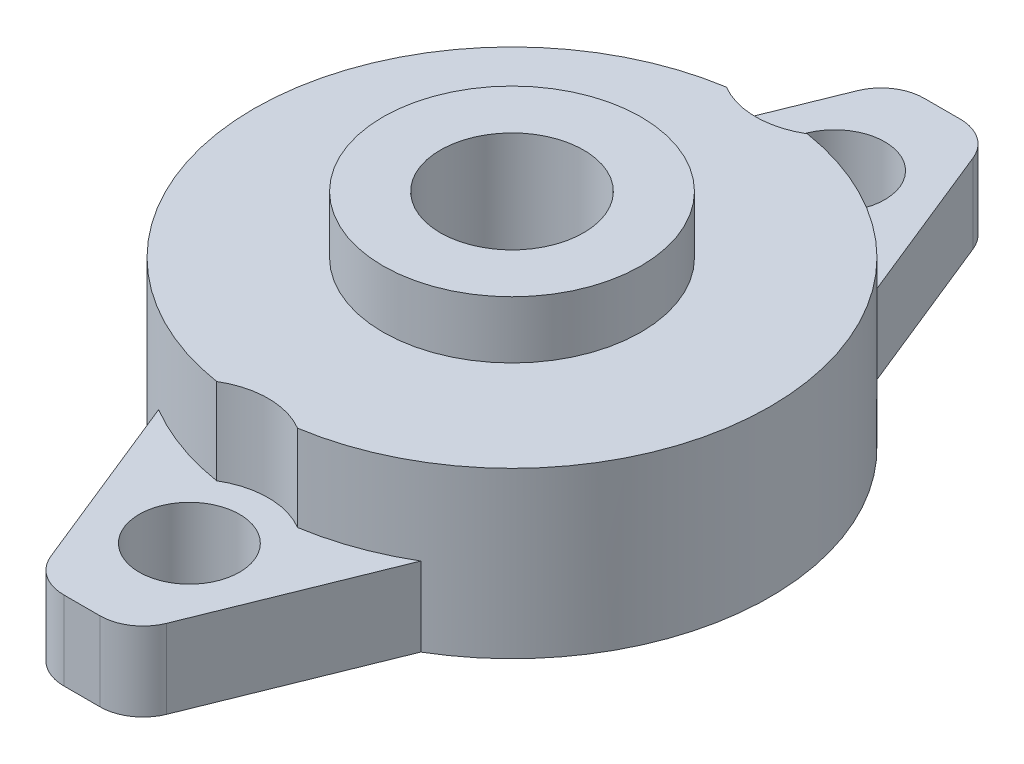
from build123d import *

# Parameters (mm, degrees)
SKETCH1_R      = 3.5
EXTRUDE1_DEPTH = 5.5
EXTRUDE2_DEPTH = 6
SKETCH3_R      = 9
EXTRUDE3_DEPTH = 4
SKETCH4_R      = 5
EXTRUDE4_DEPTH = 20
SKETCH5_R      = 14
EXTRUDE5_DEPTH = 1.5


with BuildPart() as part:
    # Sketch1 → Extrude1 (new body)
    with BuildSketch(Plane(origin=(0, 0, 0), x_dir=(1, 0, 0), z_dir=(0, 1, 0))):
        with BuildLine():
            Line((-9.142025191, 15.505591746), (-4.043990115, 28.123809223))
            ThreePointArc((-4.043990115, 28.123809223), (-2.940017716, 29.487109534), (-1.262434286, 30))
            Line((-1.262434286, 30), (1.262434286, 30))
            ThreePointArc((1.262434286, 30), (2.940017716, 29.487109534), (4.043990115, 28.123809223))
            Line((4.043990115, 28.123809223), (9.142025191, 15.505591746))
            ThreePointArc((9.142025191, 15.505591746), (18, 0), (9.142025191, -15.505591746))
            Line((9.142025191, -15.505591746), (4.043990115, -28.123809223))
            ThreePointArc((4.043990115, -28.123809223), (2.940017716, -29.487109534), (1.262434286, -30))
            Line((1.262434286, -30), (-1.262434286, -30))
            ThreePointArc((-1.262434286, -30), (-2.940017716, -29.487109534), (-4.043990115, -28.123809223))
            Line((-4.043990115, -28.123809223), (-9.142025191, -15.505591746))
            ThreePointArc((-9.142025191, -15.505591746), (-18, 0), (-9.142025191, 15.505591746))
        make_face()
        with Locations(Location((0, 22.5, 0), (0, 0, 270))):
            Circle(SKETCH1_R, mode=Mode.SUBTRACT)
        with Locations(Location((0, -22.5, 0), (0, 0, 270))):
            Circle(SKETCH1_R, mode=Mode.SUBTRACT)
    extrude(amount=EXTRUDE1_DEPTH)

    # Sketch2 → Extrude2 (add)
    with BuildSketch(Plane(origin=(0, 5.5, 0), x_dir=(1, 0, 0), z_dir=(0, 1, 0))):
        with BuildLine():
            ThreePointArc((2.819683898, -17.777777778), (18, 0), (2.819683898, 17.777777778))
            ThreePointArc((2.819683898, 17.777777778), (0, 17), (-2.819683898, 17.777777778))
            ThreePointArc((-2.819683898, 17.777777778), (-18, 0), (-2.819683898, -17.777777778))
            ThreePointArc((-2.819683898, -17.777777778), (0, -17), (2.819683898, -17.777777778))
        make_face()
    extrude(amount=EXTRUDE2_DEPTH)

    # Sketch3 → Extrude3 (add)
    with BuildSketch(Plane(origin=(0, 11.5, 0), x_dir=(1, 0, 0), z_dir=(0, 1, 0))):
        with Locations(Location((0, 0, 0), (0, 0, 270))):
            Circle(SKETCH3_R)
    extrude(amount=EXTRUDE3_DEPTH)

    # Sketch4 → Extrude4 (cut)
    with BuildSketch(Plane(origin=(0, 15.5, 0), x_dir=(1, 0, 0), z_dir=(0, 1, 0))):
        with Locations(Location((0, 0, 0), (0, 0, 270))):
            Circle(SKETCH4_R)
    extrude(amount=-EXTRUDE4_DEPTH, mode=Mode.SUBTRACT)

    # Sketch5 → Extrude5 (cut)
    with BuildSketch(Plane.XZ):
        with Locations(Location((0, 0, 0), (0, 0, 270))):
            Circle(SKETCH5_R)
    extrude(amount=-EXTRUDE5_DEPTH, mode=Mode.SUBTRACT)


solid = part.part
